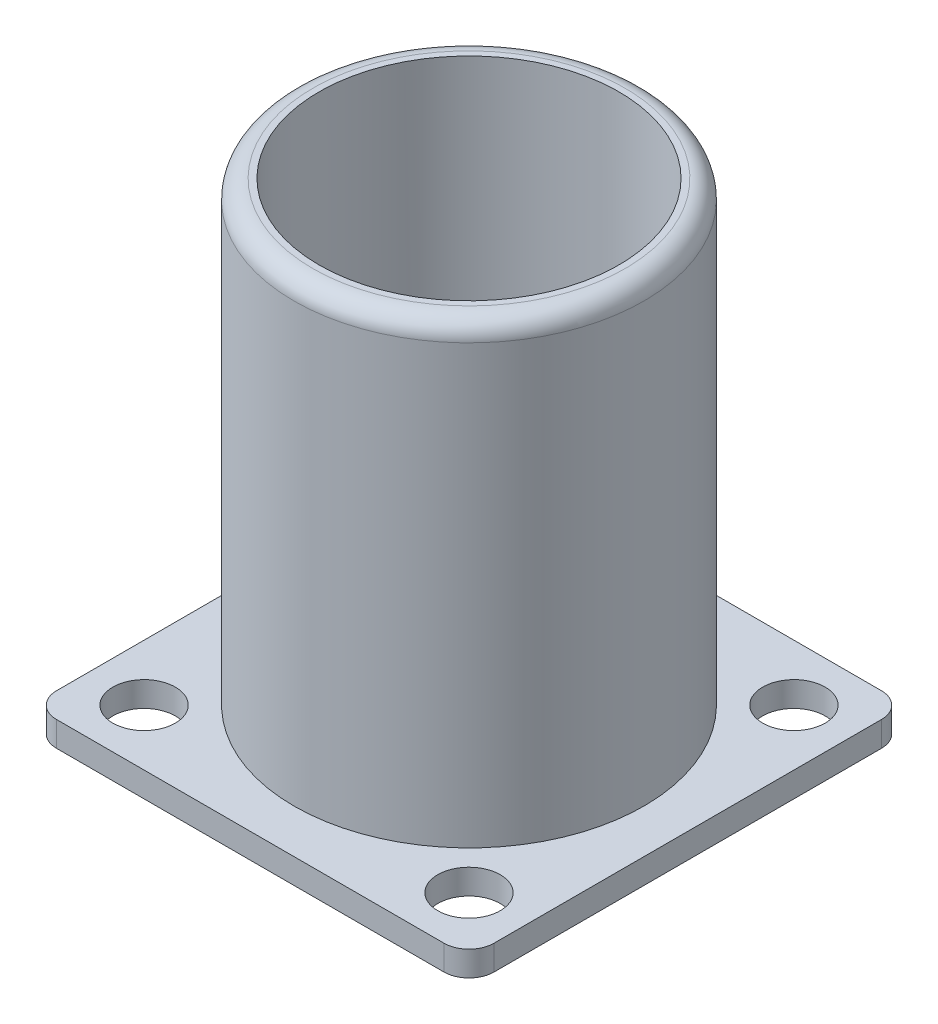
from build123d import *
from build123d.topology import SkipClean

# Parameters (mm, degrees)
ESBO_O1_W                = 35
ESBO_O1_H                = 35
RESSALTO_EXTRUS_O1_DEPTH = 2
FILETE2_R                = 2
ESBO_O3_R                = 14
ESBO_O3_R_2              = 12
RESSALTO_EXTRUS_O3_DEPTH = 36.5
FILETE3_R                = 1.5


with BuildPart() as part:
    # Esboço1 → Ressalto-extrusão1 (new body)
    with BuildSketch(Plane(origin=(0, 0, 0), x_dir=(1, 0, 0), z_dir=(0, 1, 0))):
        Rectangle(ESBO_O1_W, ESBO_O1_H)
        with BuildLine():
            ThreePointArc((-10.5, -13), (-15.304886114, -13.968245837), (-11.25, -11.214642893))
            ThreePointArc((-11.25, -11.214642893), (-10.695113886, -12.031754163), (-10.5, -13))
        make_face(mode=Mode.SUBTRACT)
        with BuildLine():
            ThreePointArc((15.5, -13), (12.031754163, -15.304886114), (11.25, -11.214642893))
            ThreePointArc((11.25, -11.214642893), (13.968245837, -10.695113886), (15.5, -13))
        make_face(mode=Mode.SUBTRACT)
        with BuildLine():
            ThreePointArc((-9.75, -6.99553429), (-10.59422921, -5.635805838), (-11.25, -4.175823272))
            Line((-11.25, -4.175823272), (-11.25, 4.175823272))
            ThreePointArc((-11.25, 4.175823272), (-10.59422921, 5.635805838), (-9.75, 6.99553429))
            Line((-9.75, 6.99553429), (-9.75, -6.99553429))
        make_face(mode=Mode.SUBTRACT)
        with BuildLine():
            ThreePointArc((-6.75, -9.921567416), (-7.524255874, -9.348025115), (-8.25, -8.714212529))
            Line((-8.25, -8.714212529), (-8.25, 8.714212529))
            ThreePointArc((-8.25, 8.714212529), (-7.524255874, 9.348025115), (-6.75, 9.921567416))
            Line((-6.75, 9.921567416), (-6.75, -9.921567416))
        make_face(mode=Mode.SUBTRACT)
        with BuildLine():
            ThreePointArc((-3.75, -11.399013115), (-4.510269977, -11.120137802), (-5.25, -10.790620927))
            Line((-5.25, -10.790620927), (-5.25, 10.790620927))
            ThreePointArc((-5.25, 10.790620927), (-4.510269977, 11.120137802), (-3.75, 11.399013115))
            Line((-3.75, 11.399013115), (-3.75, -11.399013115))
        make_face(mode=Mode.SUBTRACT)
        with BuildLine():
            Line((-0.75, 11.976539567), (-0.75, -11.976539567))
            ThreePointArc((-0.75, -11.976539567), (-1.502985267, -11.905504411), (-2.25, -11.787175234))
            Line((-2.25, -11.787175234), (-2.25, 11.787175234))
            ThreePointArc((-2.25, 11.787175234), (-1.502985267, 11.905504411), (-0.75, 11.976539567))
        make_face(mode=Mode.SUBTRACT)
        with BuildLine():
            ThreePointArc((-10.5, 13), (-10.695113886, 12.031754163), (-11.25, 11.214642893))
            ThreePointArc((-11.25, 11.214642893), (-15.304886114, 13.968245837), (-10.5, 13))
        make_face(mode=Mode.SUBTRACT)
        with BuildLine():
            ThreePointArc((2.25, -11.787175234), (1.502985267, -11.905504411), (0.75, -11.976539567))
            Line((0.75, -11.976539567), (0.75, 11.976539567))
            ThreePointArc((0.75, 11.976539567), (1.502985267, 11.905504411), (2.25, 11.787175234))
            Line((2.25, 11.787175234), (2.25, -11.787175234))
        make_face(mode=Mode.SUBTRACT)
        with BuildLine():
            ThreePointArc((5.25, -10.790620927), (4.510269977, -11.120137802), (3.75, -11.399013115))
            Line((3.75, -11.399013115), (3.75, 11.399013115))
            ThreePointArc((3.75, 11.399013115), (4.510269977, 11.120137802), (5.25, 10.790620927))
            Line((5.25, 10.790620927), (5.25, -10.790620927))
        make_face(mode=Mode.SUBTRACT)
        with BuildLine():
            ThreePointArc((8.25, -8.714212529), (7.524255874, -9.348025115), (6.75, -9.921567416))
            Line((6.75, -9.921567416), (6.75, 9.921567416))
            ThreePointArc((6.75, 9.921567416), (7.524255874, 9.348025115), (8.25, 8.714212529))
            Line((8.25, 8.714212529), (8.25, -8.714212529))
        make_face(mode=Mode.SUBTRACT)
        with BuildLine():
            ThreePointArc((11.25, -4.175823272), (10.59422921, -5.635805838), (9.75, -6.99553429))
            Line((9.75, -6.99553429), (9.75, 6.99553429))
            ThreePointArc((9.75, 6.99553429), (10.59422921, 5.635805838), (11.25, 4.175823272))
            Line((11.25, 4.175823272), (11.25, -4.175823272))
        make_face(mode=Mode.SUBTRACT)
        with BuildLine():
            ThreePointArc((15.5, 13), (13.968245837, 10.695113886), (11.25, 11.214642893))
            ThreePointArc((11.25, 11.214642893), (12.031754163, 15.304886114), (15.5, 13))
        make_face(mode=Mode.SUBTRACT)
    extrude(amount=RESSALTO_EXTRUS_O1_DEPTH)

    # Filete2
    filete2_edges = [part.edges().sort_by_distance(p)[0] for p in [
        (-17.5, 1, 17.5),
        (-17.5, 1, -17.5),
        (17.5, 1, -17.5),
        (17.5, 1, 17.5),
    ]]
    fillet(filete2_edges, radius=FILETE2_R)

    # Esboço3 → Ressalto-extrusão3 (add)
    with SkipClean():  # the faces are left unmerged after this step: merging them gives an invalid solid
        with BuildSketch(Plane(origin=(0, 2, 0), x_dir=(1, 0, 0), z_dir=(0, 1, 0))):
            with Locations(Location((0, 0, 0), (0, 0, 270))):
                Circle(ESBO_O3_R)
            with Locations(Location((0, 0, 0), (0, 0, 86.416678302))):
                Circle(ESBO_O3_R_2, mode=Mode.SUBTRACT)
        extrude(amount=RESSALTO_EXTRUS_O3_DEPTH)

    # Filete3
    filete3_edges = [part.edges().sort_by_distance(p)[0] for p in [
        (0, 38.5, -14),
    ]]
    fillet(filete3_edges, radius=FILETE3_R)


solid = part.part
